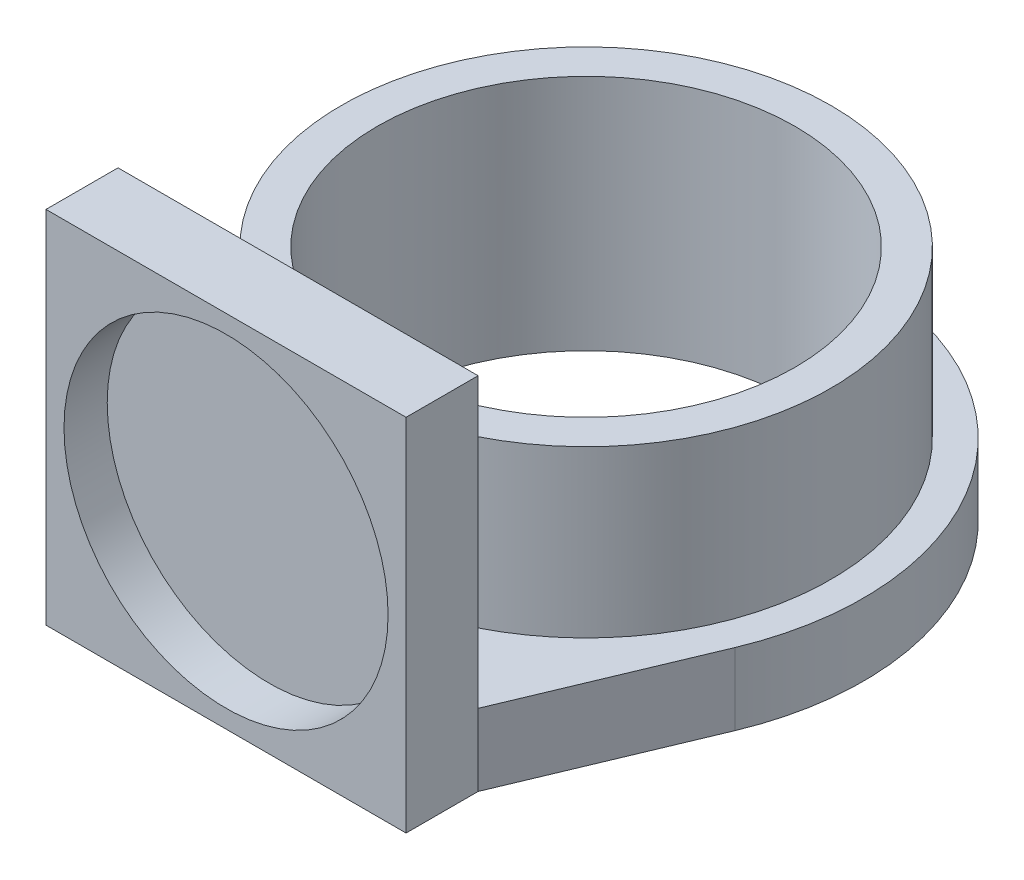
from build123d import *

# Parameters (mm, degrees)
SKETCH_1_W          = 50
SKETCH_1_H          = 50
EXTRUDE_1_DEPTH     = 10
SKETCH_2_R          = 29
EXTRUDE_2_DEPTH     = 10
SKETCH_3_R          = 22.5
CUT_EXTRUDE_1_DEPTH = 6
SKETCH_4_R          = 34
SKETCH_4_R_2        = 29
EXTRUDE_3_DEPTH     = 23


with BuildPart() as part:
    # 草图1 → 凸台-拉伸1 (new body)
    with BuildSketch(Plane.XY):
        Rectangle(SKETCH_1_W, SKETCH_1_H)
    extrude(amount=EXTRUDE_1_DEPTH)

    # 草图2 → 凸台-拉伸2 (add)
    with BuildSketch(Plane.XZ.offset(25)):
        with BuildLine():
            Line((-25, 0), (-35.517549587, -25.142218492))
            ThreePointArc((-35.517549587, -25.142218492), (0, -78.5), (35.517549587, -25.142218492))
            Line((35.517549587, -25.142218492), (25, 0))
            Line((25, 0), (-25, 0))
        make_face()
        with Locations(Location((0, -40, 0), (0, 0, 270))):
            Circle(SKETCH_2_R, mode=Mode.SUBTRACT)
    extrude(amount=-EXTRUDE_2_DEPTH)

    # 草图3 → 切除-拉伸1 (cut)
    with BuildSketch(Plane.XY.offset(10)):
        Circle(SKETCH_3_R)
    extrude(amount=-CUT_EXTRUDE_1_DEPTH, mode=Mode.SUBTRACT)

    # 草图4 → 凸台-拉伸3 (add)
    with BuildSketch(Plane(origin=(0, -15, 0), x_dir=(1, 0, 0), z_dir=(0, 1, 0))):
        with Locations(Location((0, 40, 0), (0, 0, 90))):
            Circle(SKETCH_4_R)
        with Locations(Location((0, 40, 0), (0, 0, 90))):
            Circle(SKETCH_4_R_2, mode=Mode.SUBTRACT)
    extrude(amount=EXTRUDE_3_DEPTH)


solid = part.part
